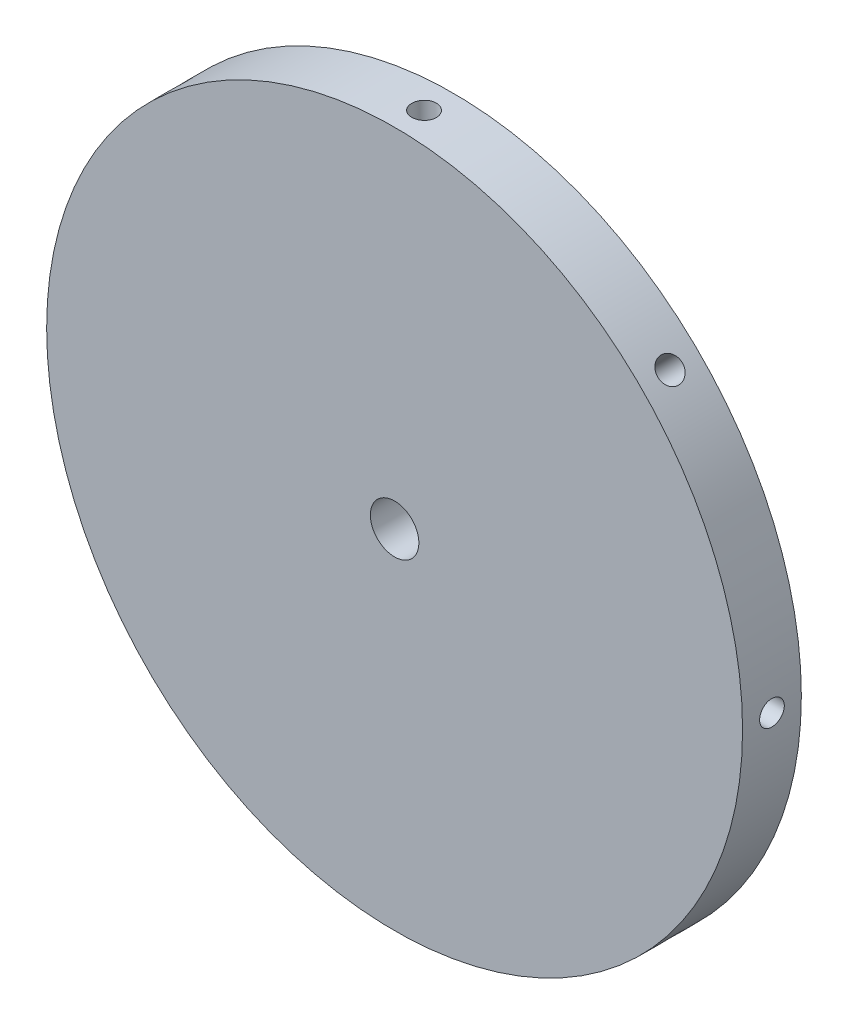
from build123d import *

# Parameters (mm, degrees)
IZIM1_R                              = 59.2
Y_KSEKLIK_EKSTR_ZYON1_DEPTH          = 10
DAIRESEL_KAPLAMA1_COUNT              = 8
M8_HELISARMAL_I_IN_Z_VANA_MATKAB_2_D = 8.25


with BuildPart() as part:
    # Çizim1 → Yükseklik-Ekstrüzyon1 (new body)
    with BuildSketch(Plane.XY):
        Circle(IZIM1_R)
    extrude(amount=Y_KSEKLIK_EKSTR_ZYON1_DEPTH)

    # Çizim10 → M4x0.7 Helisarmal İçin Dişli Delik1 (revolve, cut)
    with BuildSketch(Plane(origin=(62, 0, 5), x_dir=(0, 0, -1), z_dir=(0, 1, 0))):
        Polygon((0, 0), (0, 17.2618073), (2.1, 16), (2.1, 0), align=None)
    m4x0_7_helisarmal_in_di_li_delik1 = revolve(axis=Axis((68.35, 0, 5), (-1, 0, 0)), mode=Mode.SUBTRACT)

    # Dairesel Kaplama1: M4x0.7 Helisarmal İçin Dişli Delik1 ×8 about axis
    dairesel_kaplama1_axis = Axis((0, 0, 10), (0, 0, -1))
    for i in range(1, DAIRESEL_KAPLAMA1_COUNT):
        add(m4x0_7_helisarmal_in_di_li_delik1.rotate(dairesel_kaplama1_axis, i * 360 / DAIRESEL_KAPLAMA1_COUNT), mode=Mode.SUBTRACT)

    # M8 Helisarmal için Zıvana matkabı2 (through all)
    with Locations(Plane(origin=(0, 0, 0), x_dir=(-1, 0, 0), z_dir=(0, 0, -1))):
        with Locations((0, 0)):
            Hole(M8_HELISARMAL_I_IN_Z_VANA_MATKAB_2_D / 2)


solid = part.part
